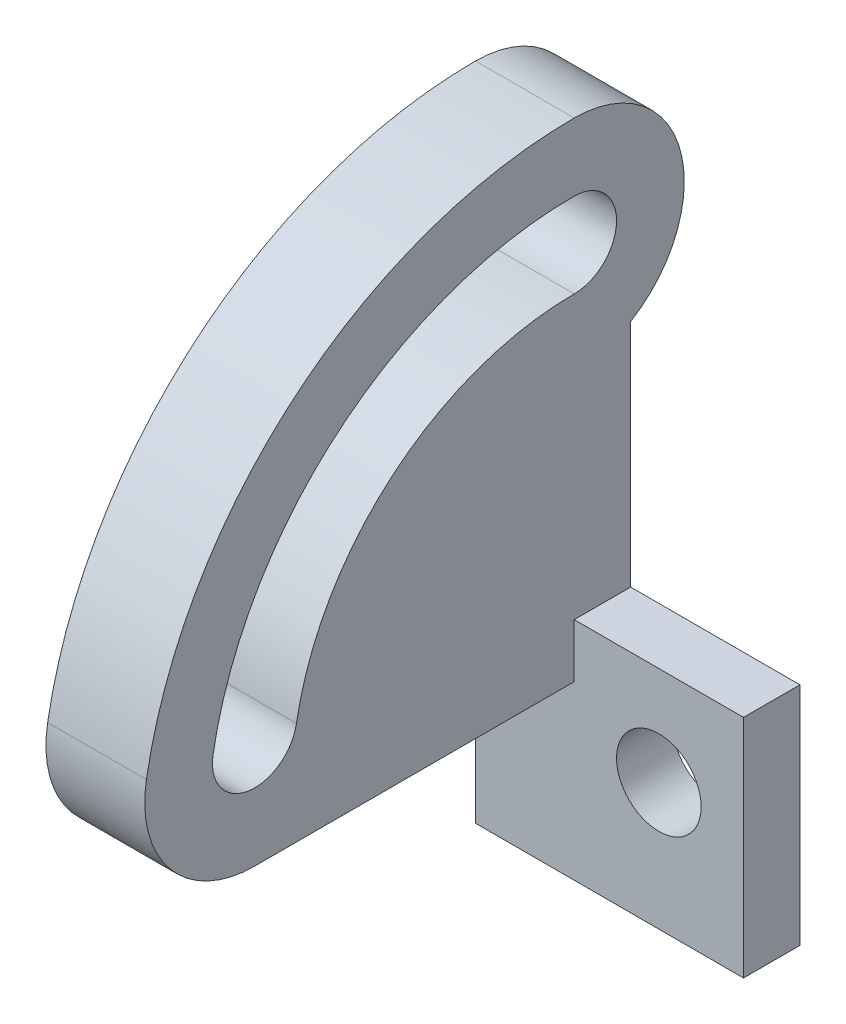
from build123d import *

# Parameters (mm, degrees)
CROQUIS1_W                   = 26
CROQUIS1_H                   = 28
CROQUIS1_R                   = 1.5
SALIENTE_EXTRUIR1_DEPTH      = 2
CROQUIS7_W                   = 3
CROQUIS7_H                   = 8
SALIENTE_EXTRUIR3_DEPTH      = 2
SALIENTE_EXTRUIR2_DEPTH      = 3
SALIENTE_EXTRUIR2_DEPTH_BACK = 0.5
CORTAR_EXTRUIR1_DEPTH        = 2


with BuildPart() as part:
    # Croquis1 → Saliente-Extruir1 (new body)
    with BuildSketch(Plane.XY):
        with Locations((-27.887270297, 1.536585366)):
            Rectangle(CROQUIS1_W, CROQUIS1_H)
        with Locations((-37.387270297, 12.036585366)):
            Circle(CROQUIS1_R, mode=Mode.SUBTRACT)
        with Locations(Location((-18.387270297, 12.036585366, 0), (0, 0, 180))):
            Circle(CROQUIS1_R, mode=Mode.SUBTRACT)
        with Locations((-27.887270297, -5.463414634)):
            Circle(CROQUIS1_R, mode=Mode.SUBTRACT)
    extrude(amount=SALIENTE_EXTRUIR1_DEPTH)

    # Croquis7 → Saliente-Extruir3 (add)
    with BuildSketch(Plane.XY.offset(2)):
        with Locations((-42.387270297, 11.536585366)):
            Rectangle(CROQUIS7_W, CROQUIS7_H)
    extrude(amount=-SALIENTE_EXTRUIR3_DEPTH)

    # Croquis4 → Saliente-Extruir2 (add, two sides: drawn at the far end of the back side and taken through both)
    with BuildSketch(Plane.ZY.offset(40.887270297).offset(-SALIENTE_EXTRUIR2_DEPTH_BACK)):
        with BuildLine():
            Line((0, 15.536585366), (0, 23.686563701))
            ThreePointArc((0, 23.686563701), (-1.75950275, 28.072068742), (2, 30.934697509))
            ThreePointArc((2, 30.934697509), (11.897715698, 27.332223608), (17.164180221, 18.210439479))
            ThreePointArc((17.164180221, 18.210439479), (16.311003312, 15.026339908), (13.323429984, 13.633211586))
            Line((13.323429984, 13.633211586), (2, 13.633211586))
            Line((2, 13.633211586), (2, 15.536585366))
            Line((2, 15.536585366), (0, 15.536585366))
        make_face()
        with BuildLine():
            ThreePointArc((14.800641614, 17.793683853), (10.355025435, 25.493716944), (2, 28.534697509))
            ThreePointArc((2, 28.534697509), (0.5, 27.034697509), (2, 25.534697509))
            ThreePointArc((2, 25.534697509), (8.426662606, 23.195583615), (11.846218354, 17.27273932))
            ThreePointArc((11.846218354, 17.27273932), (13.583902251, 16.055999957), (14.800641614, 17.793683853))
        make_face(mode=Mode.SUBTRACT)
    extrude(amount=SALIENTE_EXTRUIR2_DEPTH + SALIENTE_EXTRUIR2_DEPTH_BACK)

    # Croquis5 → Cortar-Extruir1 (cut)
    with BuildSketch(Plane.XY.offset(2)):
        Polygon((-34.387270297, 15.536585366), (-34.387270297, 7.536585366), (-40.887270297, 7.536585366), (-40.887270297, -12.463414634), (-14.887270297, -12.463414634), (-14.887270297, 15.536585366), align=None)
    extrude(amount=-CORTAR_EXTRUIR1_DEPTH, mode=Mode.SUBTRACT)


solid = part.part
